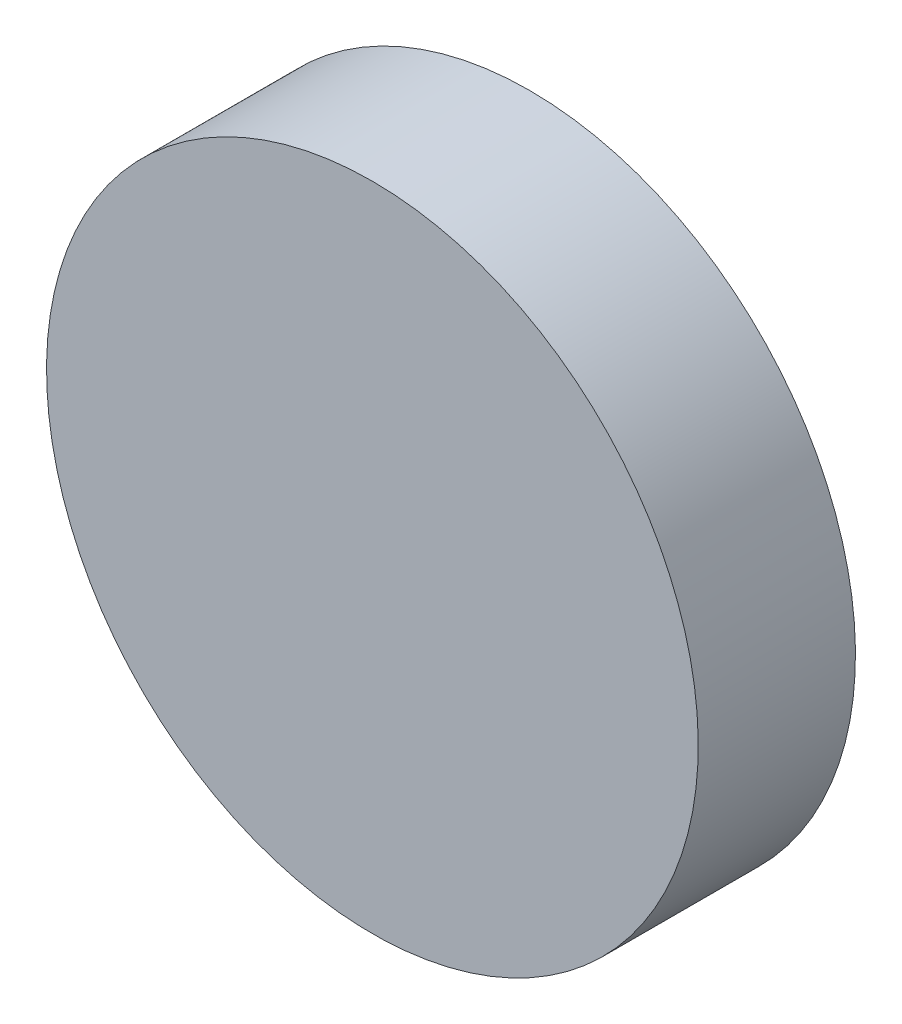
from build123d import *

# Parameters (mm, degrees)
SKETCH1_W = 40
SKETCH1_H = 19.3


with BuildPart() as part:
    # Sketch1 → Revolve1 (revolve)
    with BuildSketch(Plane.XZ, mode=Mode.PRIVATE) as revolve1_sk:
        with Locations((20, -16.15)):
            Rectangle(SKETCH1_W, SKETCH1_H)
    revolve(revolve1_sk.sketch.rotate(Axis((0, 0, -6.5), (0, 0, -1)), 270), axis=Axis((0, 0, -6.5), (0, 0, -1)))


solid = part.part
